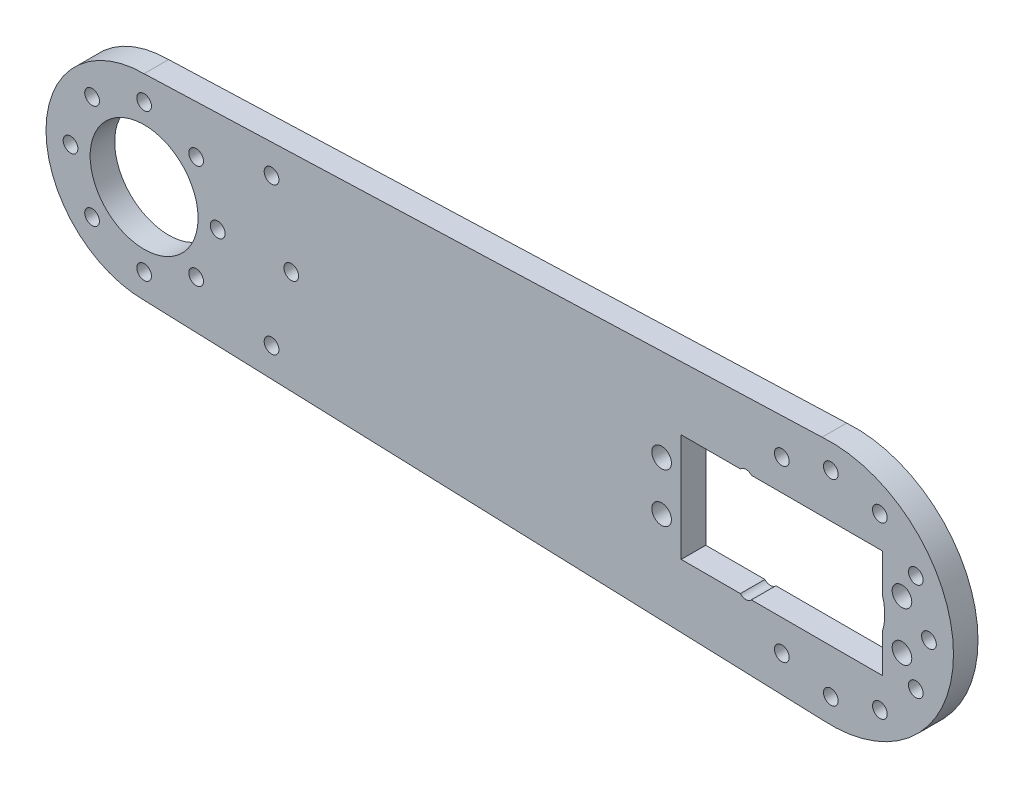
from build123d import *
from build123d.topology import SkipClean

# Parameters (mm, degrees)
EXTRUDE_3_DEPTH      = 5
SKETCH_4_R           = 4
SKETCH_4_R_2         = 1.5
CUT_EXTRUDE_3_DEPTH  = 5
SKETCH_5_R           = 11
CUT_EXTRUDE_4_DEPTH  = 2
SKETCH_6_R           = 1.5
CUT_EXTRUDE_6_DEPTH  = 169.745370307
SKETCH_7_R           = 1.5
CUT_EXTRUDE_7_DEPTH  = 10
SKETCH_8_R           = 11
CUT_EXTRUDE_8_DEPTH  = 10
SKETCH_9_R           = 1.5
CUT_EXTRUDE_9_DEPTH  = 10
SKETCH_10_R          = 5
CUT_EXTRUDE_10_DEPTH = 10
SKETCH_11_R          = 2
CUT_EXTRUDE_11_DEPTH = 10
SKETCH_12_W          = 41
SKETCH_12_H          = 22
CUT_EXTRUDE_12_DEPTH = 10


with BuildPart() as part:
    # 草图1 → 凸台-拉伸3 (new body)
    with BuildSketch(Plane.XY):
        with BuildLine():
            Line((140, 25), (0, 35))
            ThreePointArc((0, 35), (-35, 0), (0, -35))
            Line((0, -35), (140, -25))
            ThreePointArc((140, -25), (165, 0), (140, 25))
        make_face()
    extrude(amount=EXTRUDE_3_DEPTH)

    # 草图4 → 切除-拉伸3 (cut)
    with BuildSketch(Plane.XY.offset(5)):
        with Locations((140, 0)):
            Circle(SKETCH_4_R)
        Circle(SKETCH_4_R)
        with BuildLine():
            Line((-5, -3.5), (-5, -5))
            Line((-5, -5), (-3.5, -5))
            ThreePointArc((-3.5, -5), (-3.939339828, -3.939339828), (-5, -3.5))
        make_face()
        with BuildLine():
            Line((-3.5, -5), (-5, -5))
            Line((-5, -5), (-5, -3.5))
            ThreePointArc((-5, -3.5), (-6.060660172, -6.060660172), (-3.5, -5))
        make_face()
        with Locations((135, 5)):
            Circle(SKETCH_4_R_2)
        with Locations((135, -5)):
            Circle(SKETCH_4_R_2)
        with Locations((145, -5)):
            Circle(SKETCH_4_R_2)
        with Locations((145, 5)):
            Circle(SKETCH_4_R_2)
        with Locations((-5, 5)):
            Circle(SKETCH_4_R_2)
        with Locations((5, 5)):
            Circle(SKETCH_4_R_2)
        with Locations((5, -5)):
            Circle(SKETCH_4_R_2)
    extrude(amount=-CUT_EXTRUDE_3_DEPTH, mode=Mode.SUBTRACT)

    # 草图5 → 切除-拉伸4 (cut)
    with BuildSketch(Plane.XY.offset(5)):
        Circle(SKETCH_5_R)
        with Locations((140, 0)):
            Circle(SKETCH_5_R)
    extrude(amount=-CUT_EXTRUDE_4_DEPTH, mode=Mode.SUBTRACT)

    # 草图6 → 切除-拉伸6 (cut, through all)
    with BuildSketch(Plane.XY.offset(5)):
        with Locations((0, 30)):
            Circle(SKETCH_6_R)
        with Locations((15, 25.980762114)):
            Circle(SKETCH_6_R)
        with Locations((25.980762114, 15)):
            Circle(SKETCH_6_R)
        with Locations((30, 0)):
            Circle(SKETCH_6_R)
        with Locations((25.980762114, -15)):
            Circle(SKETCH_6_R)
        with Locations((15, -25.980762114)):
            Circle(SKETCH_6_R)
        with Locations((0, -30)):
            Circle(SKETCH_6_R)
        with Locations((-15, -25.980762114)):
            Circle(SKETCH_6_R)
        with Locations((-25.980762114, -15)):
            Circle(SKETCH_6_R)
        with Locations((-30, 0)):
            Circle(SKETCH_6_R)
        with Locations((-25.980762114, 15)):
            Circle(SKETCH_6_R)
        with Locations((-15, 25.980762114)):
            Circle(SKETCH_6_R)
        with Locations((140, 20)):
            Circle(SKETCH_6_R)
        with Locations((150, 17.320508076)):
            Circle(SKETCH_6_R)
        with Locations((157.320508076, 10)):
            Circle(SKETCH_6_R)
        with Locations((160, 0)):
            Circle(SKETCH_6_R)
        with Locations((157.320508076, -10)):
            Circle(SKETCH_6_R)
        with Locations((150, -17.320508076)):
            Circle(SKETCH_6_R)
        with Locations((140, -20)):
            Circle(SKETCH_6_R)
        with Locations((130, -17.320508076)):
            Circle(SKETCH_6_R)
        with Locations((122.679491924, -10)):
            Circle(SKETCH_6_R)
        with Locations((120, 0)):
            Circle(SKETCH_6_R)
        with Locations((122.679491924, 10)):
            Circle(SKETCH_6_R)
        with Locations((130, 17.320508076)):
            Circle(SKETCH_6_R)
    extrude(amount=-CUT_EXTRUDE_6_DEPTH, mode=Mode.SUBTRACT)

    # 草图7 → 切除-拉伸7 (cut)
    with SkipClean():  # the faces are left unmerged after this step: merging them gives an invalid solid
        with BuildSketch(Plane.XY.offset(5)):
            with BuildLine():
                ThreePointArc((138.21656051, 24.936305732), (139.107711737, 24.984071359), (140, 25))
                Line((140, 25), (0, 35))
                ThreePointArc((0, 35), (-35, 0), (0, -35))
                Line((0, -35), (140, -25))
                ThreePointArc((140, -25), (139.107711737, -24.984071359), (138.21656051, -24.936305732))
                Line((138.21656051, -24.936305732), (0, -20))
                ThreePointArc((0, -20), (-20, 0), (0, 20))
                Line((0, 20), (138.21656051, 24.936305732))
            make_face()
            with Locations((0, -30)):
                Circle(SKETCH_7_R, mode=Mode.SUBTRACT)
            with Locations((-15, -25.980762114)):
                Circle(SKETCH_7_R, mode=Mode.SUBTRACT)
            with Locations((15, -25.980762114)):
                Circle(SKETCH_7_R, mode=Mode.SUBTRACT)
            with Locations((-25.980762114, -15)):
                Circle(SKETCH_7_R, mode=Mode.SUBTRACT)
            with Locations((-30, 0)):
                Circle(SKETCH_7_R, mode=Mode.SUBTRACT)
            with Locations((-25.980762114, 15)):
                Circle(SKETCH_7_R, mode=Mode.SUBTRACT)
            with Locations((-15, 25.980762114)):
                Circle(SKETCH_7_R, mode=Mode.SUBTRACT)
            with Locations((0, 30)):
                Circle(SKETCH_7_R, mode=Mode.SUBTRACT)
            with Locations((15, 25.980762114)):
                Circle(SKETCH_7_R, mode=Mode.SUBTRACT)
        extrude(amount=-CUT_EXTRUDE_7_DEPTH, mode=Mode.SUBTRACT)

    # 草图8 → 切除-拉伸8 (cut)
    with SkipClean():  # the faces are left unmerged after this step: merging them gives an invalid solid
        with BuildSketch(Plane.XY.offset(5)):
            Circle(SKETCH_8_R)
        extrude(amount=-CUT_EXTRUDE_8_DEPTH, mode=Mode.SUBTRACT)

    # 草图9 → 切除-拉伸9 (cut)
    with SkipClean():  # the faces are left unmerged after this step: merging them gives an invalid solid
        with BuildSketch(Plane.XY.offset(5)):
            with Locations((0, 15)):
                Circle(SKETCH_9_R)
            with Locations((10.606601718, 10.606601718)):
                Circle(SKETCH_9_R)
            with Locations((15, 0)):
                Circle(SKETCH_9_R)
            with Locations((10.606601718, -10.606601718)):
                Circle(SKETCH_9_R)
            with Locations((0, -15)):
                Circle(SKETCH_9_R)
            with Locations((-10.606601718, -10.606601718)):
                Circle(SKETCH_9_R)
            with Locations((-15, 0)):
                Circle(SKETCH_9_R)
            with Locations((-10.606601718, 10.606601718)):
                Circle(SKETCH_9_R)
        extrude(amount=-CUT_EXTRUDE_9_DEPTH, mode=Mode.SUBTRACT)

    # 草图10 → 切除-拉伸10 (cut)
    with SkipClean():  # the faces are left unmerged after this step: merging them gives an invalid solid
        with BuildSketch(Plane.XY.offset(3)):
            with Locations((140, 0)):
                Circle(SKETCH_10_R)
        extrude(amount=-CUT_EXTRUDE_10_DEPTH, mode=Mode.SUBTRACT)

    # 草图11 → 切除-拉伸11 (cut)
    with SkipClean():  # the faces are left unmerged after this step: merging them gives an invalid solid
        with BuildSketch(Plane.XY.offset(5)):
            with Locations((105.5, 5)):
                Circle(SKETCH_11_R)
            Polygon((110, 10), (110, 0), (110, -10), (150, -10), (150, 10), align=None)
            with Locations((105.5, -5)):
                Circle(SKETCH_11_R)
            with Locations((154.5, -5)):
                Circle(SKETCH_11_R)
            with Locations((154.5, 5)):
                Circle(SKETCH_11_R)
        extrude(amount=-CUT_EXTRUDE_11_DEPTH, mode=Mode.SUBTRACT)

    # 草图12 → 切除-拉伸12 (cut)
    with SkipClean():  # the faces are left unmerged after this step: merging them gives an invalid solid
        with BuildSketch(Plane.XY.offset(5)):
            with Locations((130, 0)):
                Rectangle(SKETCH_12_W, SKETCH_12_H)
        extrude(amount=-CUT_EXTRUDE_12_DEPTH, mode=Mode.SUBTRACT)


solid = part.part
